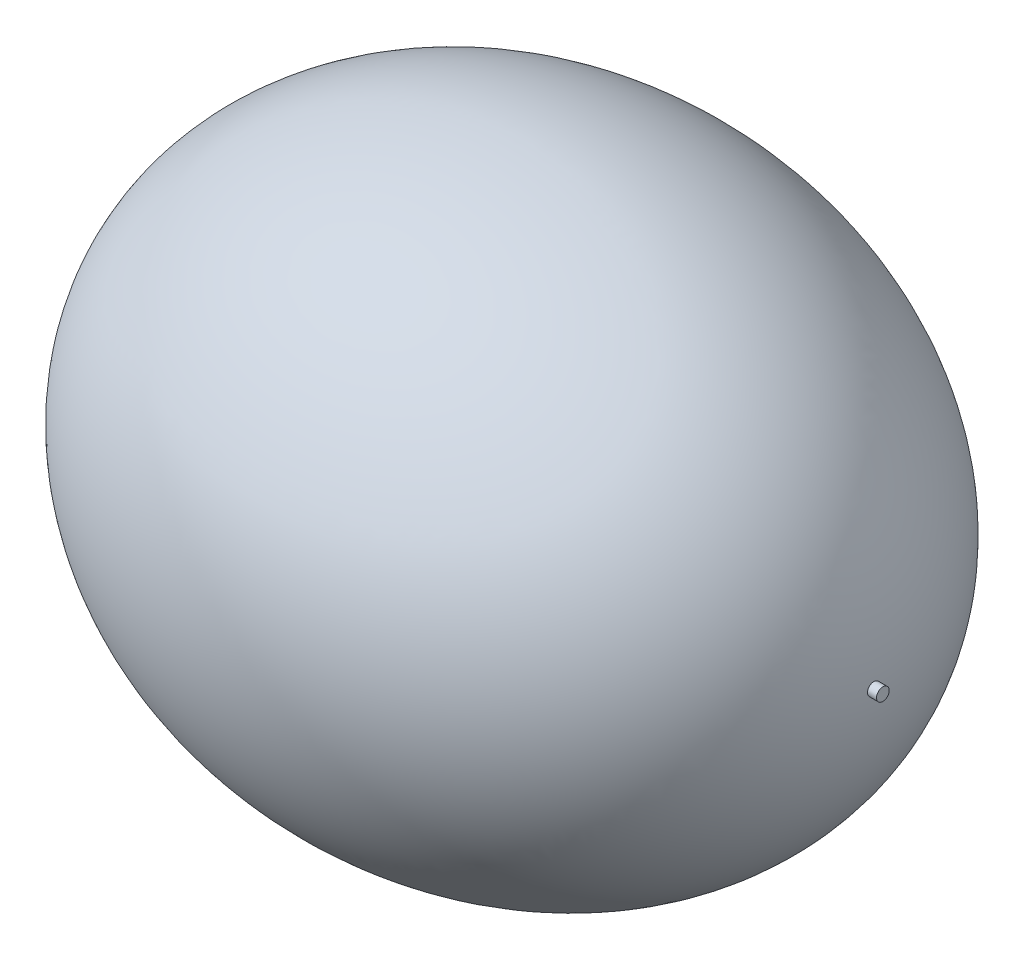
from build123d import *

# Parameters (mm, degrees)
SKETCH4_W = 10
SKETCH4_H = 7


with BuildPart() as part:
    # Sketch1 → Revolve3 (revolve)
    with BuildSketch(Plane(origin=(0, 0, 0), x_dir=(1, 0, 0), z_dir=(0, 1, 0))):
        with BuildLine():
            Line((0, 325), (0, 0))
            Line((0, 0), (399.416909125, 0))
            Line((399.416909125, 0), (399.416909125, 4))
            Line((399.416909125, 4), (399.969702995, 4))
            add(Edge.make_bspline(
                [(399.969702995, 4), (395.106849463, 325), (0, 325)],
                knots=[3.153900657, 3.153900657, 3.153900657, 4.71238898, 4.71238898, 4.71238898], degree=2, weights=[1, 0.7114449, 1]))
        make_face()
        with BuildLine():
            Line((-400, 0), (0, 0))
            Line((0, 0), (0, 325))
            add(Edge.make_bspline(
                [(0, 325), (-400, 325), (-400, 0)],
                knots=[4.71238898, 4.71238898, 4.71238898, 6.283185307, 6.283185307, 6.283185307], degree=2, weights=[1, 0.707106781, 1]))
        make_face()
    revolve(axis=Axis((0, 0, 0), (-1, 0, 0)))


with BuildPart() as body_2:
    # Sketch4 → Revolve4 (revolve)
    with BuildSketch(Plane.XY, mode=Mode.PRIVATE) as revolve4_sk:
        with Locations((404.969702995, 3.5)):
            Rectangle(SKETCH4_W, SKETCH4_H)
    revolve(revolve4_sk.sketch.rotate(Axis((399.969702995, 0, 0), (1, 0, 0)), 90), axis=Axis((399.969702995, 0, 0), (1, 0, 0)))


solid = Compound([part.part, body_2.part])
